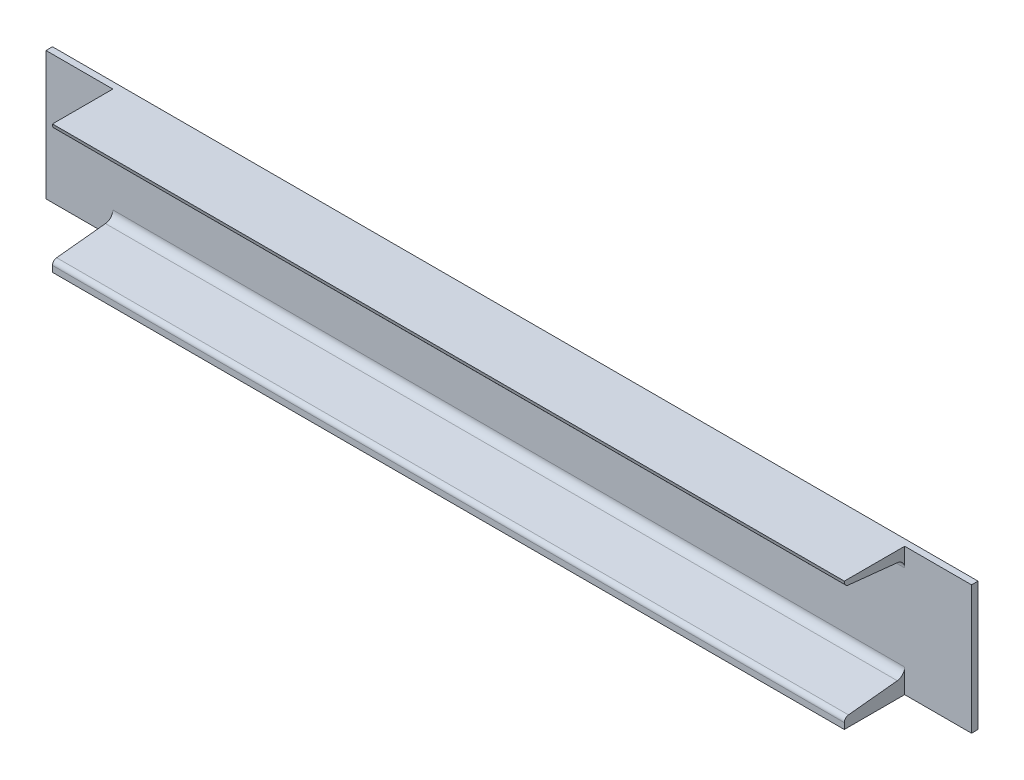
from build123d import *

# Parameters (mm, degrees)
C_CHANNEL_120_X_12_1_DEPTH = 900
CUT_EXTRUDE1_DEPTH         = 65


with BuildPart() as part:
    # Sketch12 → C channel 120 X 12(1) (new body)
    with BuildSketch(Plane.ZY):
        with BuildLine():
            Line((65, 125), (0, 125))
            Line((0, 125), (0, 0))
            Line((0, 0), (65, 0))
            Line((65, 0), (65, 5.845330836))
            ThreePointArc((65, 5.845330836), (63.844151715, 8.856418565), (60.970378085, 10.320679365))
            Line((60.970378085, 10.320679365), (13.463772294, 15.313824837))
            ThreePointArc((13.463772294, 15.313824837), (8.354841396, 17.916955149), (6.3, 23.27))
            Line((6.3, 23.27), (6.3, 106.74))
            ThreePointArc((6.3, 106.74), (8.354841396, 112.093044851), (13.463772294, 114.696175163))
            Line((13.463772294, 114.696175163), (60.970378085, 119.689320635))
            ThreePointArc((60.970378085, 119.689320635), (63.844151715, 121.153581435), (65, 124.164669164))
            Line((65, 124.164669164), (65, 125))
        make_face()
    extrude(amount=C_CHANNEL_120_X_12_1_DEPTH)

    # Sketch13 → Cut-Extrude1 (cut)
    with BuildSketch(Plane(origin=(0, 0, 0), x_dir=(0, 0, -1), z_dir=(1, 0, 0))):
        Polygon((-6.3, 106.74), (-6.3, 128.866505143), (-71.707289192, 128.866505143), (-71.707289192, -13.872532072), (-6.3, -13.872532072), align=None)
    cut_extrude1 = extrude(amount=-CUT_EXTRUDE1_DEPTH, mode=Mode.SUBTRACT)

    # Mirror1: Cut-Extrude1 across plane
    add(cut_extrude1.mirror(Plane(origin=(-450, 0, 0), x_dir=(0, 0, 1), z_dir=(1, 0, 0))), mode=Mode.SUBTRACT)


solid = part.part
